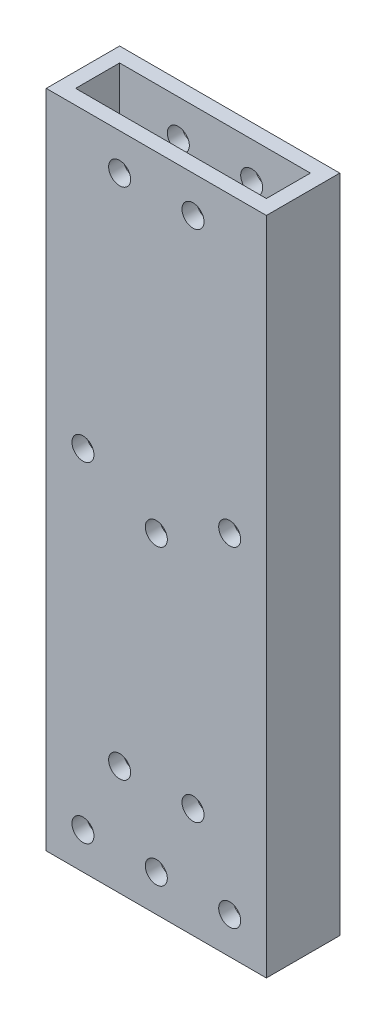
from build123d import *

# Parameters (mm, degrees)
SKETCH_1_W          = 30
SKETCH_1_H          = 10
SKETCH_1_W_2        = 26
SKETCH_1_H_2        = 6
EXTRUDE_1_DEPTH     = 45
SKETCH_2_R          = 1.5
CUT_EXTRUDE_1_DEPTH = 49.476798574


with BuildPart() as part:
    # 草图1 → 凸台-拉伸1 (new, symmetric)
    with BuildSketch(Plane(origin=(0, 0, 0), x_dir=(1, 0, 0), z_dir=(0, 1, 0))):
        Rectangle(SKETCH_1_W, SKETCH_1_H)
        Rectangle(SKETCH_1_W_2, SKETCH_1_H_2, mode=Mode.SUBTRACT)
    extrude(amount=EXTRUDE_1_DEPTH, both=True)

    # 草图2 → 切除-拉伸1 (cut, through all)
    with BuildSketch(Plane.XY.offset(5)):
        with Locations((5, 40)):
            Circle(SKETCH_2_R)
        with Locations((10, 5)):
            Circle(SKETCH_2_R)
        Circle(SKETCH_2_R)
        with Locations((-10, 5)):
            Circle(SKETCH_2_R)
        with Locations((-5, 40)):
            Circle(SKETCH_2_R)
        with Locations((5, -30)):
            Circle(SKETCH_2_R)
        with Locations((-5, -30)):
            Circle(SKETCH_2_R)
        with Locations((-10, -40)):
            Circle(SKETCH_2_R)
        with Locations((0, -40)):
            Circle(SKETCH_2_R)
        with Locations((10, -40)):
            Circle(SKETCH_2_R)
    extrude(amount=-CUT_EXTRUDE_1_DEPTH, mode=Mode.SUBTRACT)


solid = part.part
